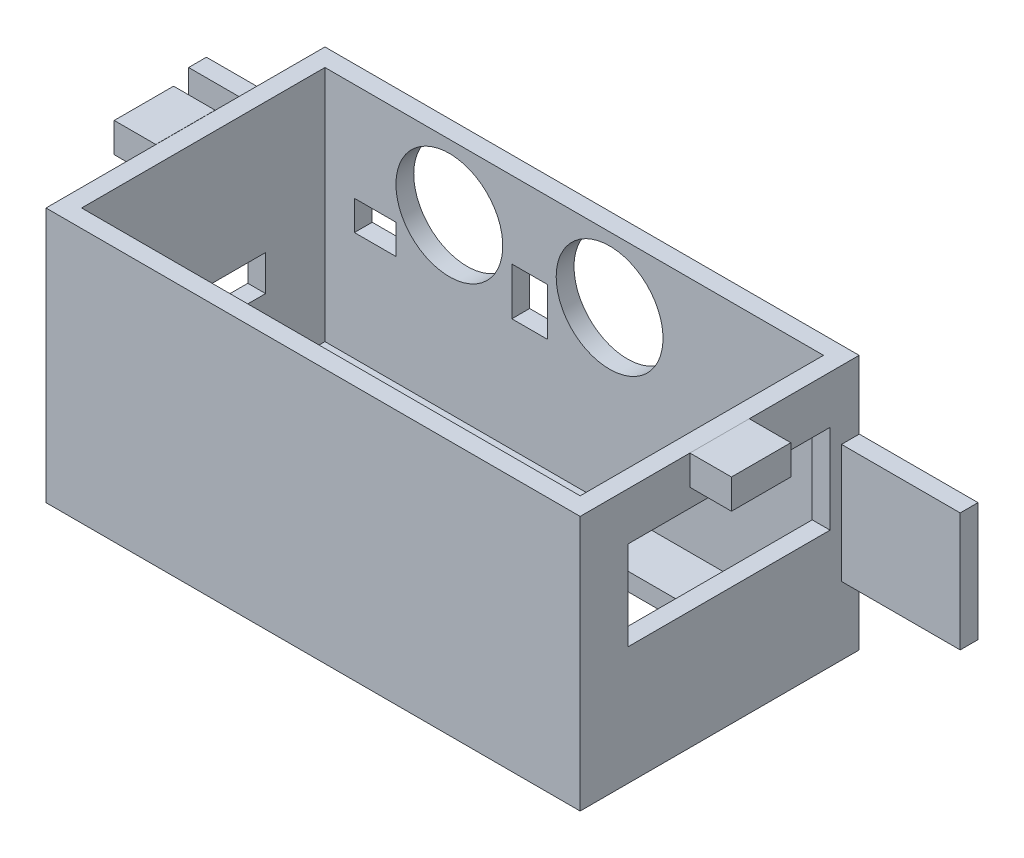
from build123d import *

# Parameters (mm, degrees)
CROQUIS1_W              = 90
CROQUIS1_H              = 47
SALIENTE_EXTRUIR1_DEPTH = 3
CROQUIS2_W              = 90
CROQUIS2_H              = 47
CROQUIS2_W_2            = 84
CROQUIS2_H_2            = 41
SALIENTE_EXTRUIR2_DEPTH = 40
CROQUIS6_W              = 72
CROQUIS6_H              = 25
CORTAR_EXTRUIR5_DEPTH   = 3
CROQUIS8_W              = 34
CROQUIS8_H              = 15
CORTAR_EXTRUIR6_DEPTH   = 3
CROQUIS9_W              = 9.999999999
CROQUIS9_H              = 5
SALIENTE_EXTRUIR3_DEPTH = 7
CROQUIS10_W             = 3
CROQUIS10_H             = 20
SALIENTE_EXTRUIR4_DEPTH = 20
CROQUIS12_W             = 3
CROQUIS12_H             = 20
SALIENTE_EXTRUIR5_DEPTH = 20
CROQUIS13_W             = 10
CROQUIS13_H             = 5
SALIENTE_EXTRUIR6_DEPTH = 7
CROQUIS14_W             = 11
CROQUIS14_H             = 6
CORTAR_EXTRUIR8_DEPTH   = 3
CROQUIS15_R             = 9
CROQUIS15_W             = 7
CROQUIS15_H             = 5
CROQUIS15_W_2           = 6
CROQUIS15_H_2           = 8
CORTAR_EXTRUIR9_DEPTH   = 3


with BuildPart() as part:
    # Croquis1 → Saliente-Extruir1 (new body)
    with BuildSketch(Plane(origin=(0, 0, 0), x_dir=(1, 0, 0), z_dir=(0, 1, 0))):
        Rectangle(CROQUIS1_W, CROQUIS1_H)
    extrude(amount=SALIENTE_EXTRUIR1_DEPTH)

    # Croquis2 → Saliente-Extruir2 (add)
    with BuildSketch(Plane(origin=(0, 3, 0), x_dir=(1, 0, 0), z_dir=(0, 1, 0))):
        Rectangle(CROQUIS2_W, CROQUIS2_H)
        Rectangle(CROQUIS2_W_2, CROQUIS2_H_2, mode=Mode.SUBTRACT)
    extrude(amount=SALIENTE_EXTRUIR2_DEPTH)

    # Croquis6 → Cortar-Extruir5 (cut)
    with BuildSketch(Plane(origin=(0, 0, 0), x_dir=(-1, 0, 0), z_dir=(0, -1, 0))):
        with Locations((0.009067855, 0.029457722)):
            Rectangle(CROQUIS6_W, CROQUIS6_H)
    extrude(amount=-CORTAR_EXTRUIR5_DEPTH, mode=Mode.SUBTRACT)

    # Croquis8 → Cortar-Extruir6 (cut)
    with BuildSketch(Plane(origin=(45, 0, 0), x_dir=(0, 0, -1), z_dir=(1, 0, 0))):
        with Locations((1.598714356, 27.442281593)):
            Rectangle(CROQUIS8_W, CROQUIS8_H)
    extrude(amount=-CORTAR_EXTRUIR6_DEPTH, mode=Mode.SUBTRACT)

    # Croquis9 → Saliente-Extruir3 (add)
    with BuildSketch(Plane(origin=(45, 0, 0), x_dir=(0, 0, -1), z_dir=(1, 0, 0))):
        with Locations((-0.008616077, 40.502224836)):
            Rectangle(CROQUIS9_W, CROQUIS9_H)
    extrude(amount=SALIENTE_EXTRUIR3_DEPTH)

    # Croquis10 → Saliente-Extruir4 (add)
    with BuildSketch(Plane(origin=(45, 0, 0), x_dir=(0, 0, -1), z_dir=(1, 0, 0))):
        with Locations((22.028285353, 21.493620383)):
            Rectangle(CROQUIS10_W, CROQUIS10_H)
    extrude(amount=SALIENTE_EXTRUIR4_DEPTH)

    # Croquis12 → Saliente-Extruir5 (add)
    with BuildSketch(Plane.ZY.offset(45)):
        with Locations((-22.029401758, 21.485642244)):
            Rectangle(CROQUIS12_W, CROQUIS12_H)
    extrude(amount=SALIENTE_EXTRUIR5_DEPTH)

    # Croquis13 → Saliente-Extruir6 (add)
    with BuildSketch(Plane.ZY.offset(45)):
        with Locations((0.007263923, 40.528739096)):
            Rectangle(CROQUIS13_W, CROQUIS13_H)
    extrude(amount=SALIENTE_EXTRUIR6_DEPTH)

    # Croquis14 → Cortar-Extruir8 (cut)
    with BuildSketch(Plane.ZY.offset(45)):
        with Locations((-5.001075708, 18.007541224)):
            Rectangle(CROQUIS14_W, CROQUIS14_H)
    extrude(amount=-CORTAR_EXTRUIR8_DEPTH, mode=Mode.SUBTRACT)

    # Croquis15 → Cortar-Extruir9 (cut)
    with BuildSketch(Plane(origin=(0, 0, -23.5), x_dir=(-1, 0, 0), z_dir=(0, 0, -1))):
        with Locations((-5.958347551, 31.946109842)):
            Circle(CROQUIS15_R)
        with Locations((21.041652448, 31.946109842)):
            Circle(CROQUIS15_R)
        with Locations((33.5380591, 23.898149155)):
            Rectangle(CROQUIS15_W, CROQUIS15_H)
        with Locations((7.510757726, 26.075310147)):
            Rectangle(CROQUIS15_W_2, CROQUIS15_H_2)
    extrude(amount=-CORTAR_EXTRUIR9_DEPTH, mode=Mode.SUBTRACT)


solid = part.part
